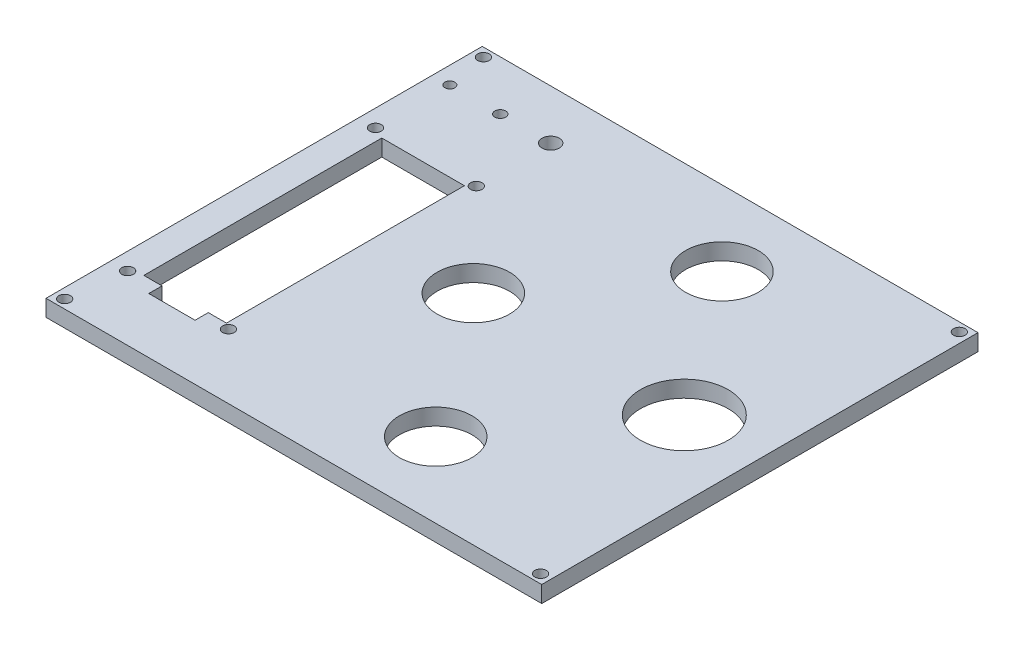
from build123d import *

# Parameters (mm, degrees)
SKETCH1_W           = 150
SKETCH1_H           = 132
SKETCH1_R           = 1.75
BOSS_EXTRUDE1_DEPTH = 5
SKETCH2_R           = 1.75
CUT_EXTRUDE1_DEPTH  = 5
SKETCH3_R           = 1.5
SKETCH3_R_2         = 1.64
SKETCH3_R_3         = 2.61
CUT_EXTRUDE2_DEPTH  = 5
SKETCH4_R           = 10.975
SKETCH4_R_2         = 13.275
CUT_EXTRUDE3_DEPTH  = 5


with BuildPart() as part:
    # Sketch1 → Boss-Extrude1 (new body)
    with BuildSketch(Plane(origin=(0, 0, 0), x_dir=(1, 0, 0), z_dir=(0, 1, 0))):
        Rectangle(SKETCH1_W, SKETCH1_H)
        with Locations(Location((71.997145932, 63.35748842, 0), (0, 0, 270))):
            Circle(SKETCH1_R, mode=Mode.SUBTRACT)
        with Locations(Location((71.997145932, -63.35748842, 0), (0, 0, 90))):
            Circle(SKETCH1_R, mode=Mode.SUBTRACT)
        with Locations(Location((-71.997145932, 63.35748842, 0), (0, 0, 90))):
            Circle(SKETCH1_R, mode=Mode.SUBTRACT)
        with Locations(Location((-71.997145932, -63.35748842, 0), (0, 0, 270))):
            Circle(SKETCH1_R, mode=Mode.SUBTRACT)
    extrude(amount=BOSS_EXTRUDE1_DEPTH)

    # Sketch2 → Cut-Extrude1 (cut)
    with BuildSketch(Plane.XZ):
        Polygon((-41.2, -26.8), (-41.2, 45.2), (-46.7, 45.2), (-46.7, 49.2), (-60.7, 49.2), (-60.7, 45.2), (-66.2, 45.2), (-66.2, -26.8), align=None)
        with Locations(Location((-39.3, 46.5, 0), (0, 0, 270))):
            Circle(SKETCH2_R)
        with Locations(Location((-39.3, -28.5, 0), (0, 0, 90))):
            Circle(SKETCH2_R)
        with Locations(Location((-69.8, 46.5, 0), (0, 0, 270))):
            Circle(SKETCH2_R)
        with Locations(Location((-69.8, -28.5, 0), (0, 0, 270))):
            Circle(SKETCH2_R)
    extrude(amount=-CUT_EXTRUDE1_DEPTH, mode=Mode.SUBTRACT)

    # Sketch3 → Cut-Extrude2 (cut)
    with BuildSketch(Plane(origin=(0, 5, 0), x_dir=(1, 0, 0), z_dir=(0, 1, 0))):
        with Locations(Location((-69.8, 51, 0), (0, 0, 270))):
            Circle(SKETCH3_R)
        with Locations(Location((-54.55, 51, 0), (0, 0, 270))):
            Circle(SKETCH3_R_2)
        with Locations(Location((-39.3, 51, 0), (0, 0, 270))):
            Circle(SKETCH3_R_3)
    extrude(amount=-CUT_EXTRUDE2_DEPTH, mode=Mode.SUBTRACT)

    # Sketch4 → Cut-Extrude3 (cut)
    with BuildSketch(Plane(origin=(0, 5, 0), x_dir=(1, 0, 0), z_dir=(0, 1, 0))):
        with Locations(Location((-11.7, 0, 0), (0, 0, 270))):
            Circle(SKETCH4_R)
        with Locations(Location((20.217797346, 43.3, 0), (0, 0, 270))):
            Circle(SKETCH4_R)
        with Locations(Location((20.217797346, -43.3, 0), (0, 0, 270))):
            Circle(SKETCH4_R)
        with Locations(Location((52.135594693, 0, 0), (0, 0, 270))):
            Circle(SKETCH4_R_2)
    extrude(amount=-CUT_EXTRUDE3_DEPTH, mode=Mode.SUBTRACT)


solid = part.part
